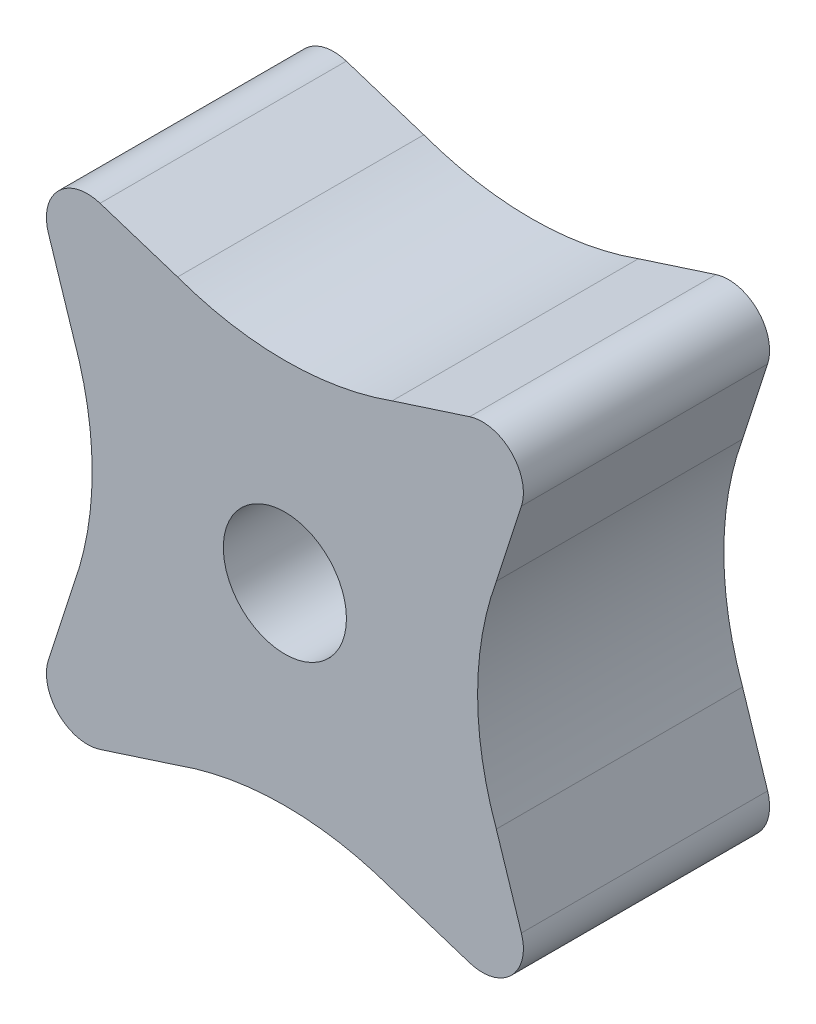
from build123d import *

# Parameters (mm, degrees)
CROQUIS1_R              = 1.5
SALIENTE_EXTRUIR1_DEPTH = 6


with BuildPart() as part:
    # Croquis1 → Saliente-Extruir1 (new body)
    with BuildSketch(Plane.XY):
        with BuildLine():
            Line((-5.15257064, 2.614937985), (-5.762938925, 4.503911831))
            ThreePointArc((-5.762938925, 4.503911831), (-5.518487605, 5.518487605), (-4.503911831, 5.762938925))
            Line((-4.503911831, 5.762938925), (-2.614937985, 5.15257064))
            ThreePointArc((-2.614937985, 5.15257064), (0, 4.696135045), (2.614937985, 5.15257064))
            Line((2.614937985, 5.15257064), (4.503911831, 5.762938925))
            ThreePointArc((4.503911831, 5.762938925), (5.518487605, 5.518487605), (5.762938925, 4.503911831))
            Line((5.762938925, 4.503911831), (5.15257064, 2.614937985))
            ThreePointArc((5.15257064, 2.614937985), (4.696135045, 0), (5.15257064, -2.614937985))
            Line((5.15257064, -2.614937985), (5.762938925, -4.503911831))
            ThreePointArc((5.762938925, -4.503911831), (5.518487605, -5.518487605), (4.503911831, -5.762938925))
            Line((4.503911831, -5.762938925), (2.614937985, -5.15257064))
            ThreePointArc((2.614937985, -5.15257064), (0, -4.696135045), (-2.614937985, -5.15257064))
            Line((-2.614937985, -5.15257064), (-4.503911831, -5.762938925))
            ThreePointArc((-4.503911831, -5.762938925), (-5.518487605, -5.518487605), (-5.762938925, -4.503911831))
            Line((-5.762938925, -4.503911831), (-5.15257064, -2.614937985))
            ThreePointArc((-5.15257064, -2.614937985), (-4.696135045, 0), (-5.15257064, 2.614937985))
        make_face()
        Circle(CROQUIS1_R, mode=Mode.SUBTRACT)
    extrude(amount=SALIENTE_EXTRUIR1_DEPTH)


solid = part.part
